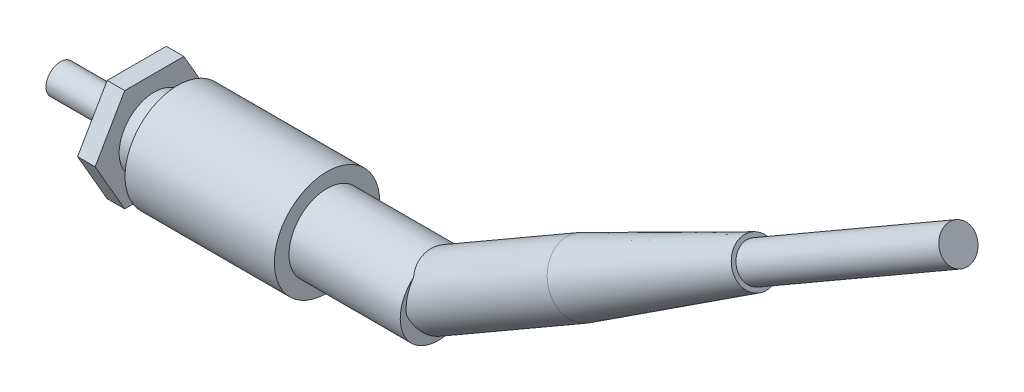
from build123d import *

# Parameters (mm, degrees)
BOSS_EXTRUDE1_DEPTH = 3
SKETCH3_R           = 6
BOSS_EXTRUDE2_DEPTH = 4
SKETCH4_R           = 9
BOSS_EXTRUDE3_DEPTH = 25.5
SKETCH5_R           = 6.5
BOSS_EXTRUDE4_DEPTH = 19
SKETCH6_R           = 2.5
BOSS_EXTRUDE5_DEPTH = 13
SKETCH8_R           = 5.5
BOSS_EXTRUDE6_DEPTH = 29
SKETCH9_R           = 5.5
BOSS_EXTRUDE7_DEPTH = 34
BOSS_EXTRUDE7_TAPER = 3
SKETCH10_R          = 3
BOSS_EXTRUDE8_DEPTH = 40


with BuildPart() as part:
    # Sketch2 → Boss-Extrude1 (new body)
    with BuildSketch(Plane(origin=(-50, 0, 0), x_dir=(0, 0, -1), z_dir=(1, 0, 0))):
        Polygon((-5.051814855, 8.75), (-10.103629711, 0), (-5.051814855, -8.75), (5.051814855, -8.75), (10.103629711, 0), (5.051814855, 8.75), align=None)
    extrude(amount=BOSS_EXTRUDE1_DEPTH)

    # Sketch3 → Boss-Extrude2 (add)
    with BuildSketch(Plane(origin=(-47, 0, 0), x_dir=(0, 0, -1), z_dir=(1, 0, 0))):
        Circle(SKETCH3_R)
    extrude(amount=BOSS_EXTRUDE2_DEPTH)

    # Sketch4 → Boss-Extrude3 (add)
    with BuildSketch(Plane(origin=(-43, 0, 0), x_dir=(0, 0, -1), z_dir=(1, 0, 0))):
        Circle(SKETCH4_R)
    extrude(amount=BOSS_EXTRUDE3_DEPTH)

    # Sketch5 → Boss-Extrude4 (add)
    with BuildSketch(Plane(origin=(-17.5, 0, 0), x_dir=(0, 0, -1), z_dir=(1, 0, 0))):
        Circle(SKETCH5_R)
    extrude(amount=BOSS_EXTRUDE4_DEPTH)

    # Sketch6 → Boss-Extrude5 (add)
    with BuildSketch(Plane.ZY.offset(50)):
        with Locations(Location((0, 0, 0), (0, 0, 180))):
            Circle(SKETCH6_R)
    extrude(amount=BOSS_EXTRUDE5_DEPTH)

    # Sketch8 → Boss-Extrude6 (add)
    with BuildSketch(Plane(origin=(1.125, 0.649519053, 0), x_dir=(0, 0, -1), z_dir=(0.8660254037844379, 0.5000000000000012, 0))):
        with Locations(Location((0, 0, 0), (0, 0, 187.837479763))):
            Circle(SKETCH8_R)
    extrude(amount=BOSS_EXTRUDE6_DEPTH)

    # Sketch9 → Boss-Extrude7 (add)
    with BuildSketch(Plane(origin=(26.23973671, 15.149519053, 0), x_dir=(0, 0, -1), z_dir=(0.8660254037844379, 0.5000000000000012, 0))):
        with Locations(Location((0, 0, 0), (0, 0, 187.837479763))):
            Circle(SKETCH9_R)
    extrude(amount=BOSS_EXTRUDE7_DEPTH, taper=BOSS_EXTRUDE7_TAPER)

    # Sketch10 → Boss-Extrude8 (add)
    with BuildSketch(Plane(origin=(55.684600438, 32.149519053, 0), x_dir=(0, 0, -1), z_dir=(0.8660254037844379, 0.5000000000000012, 0))):
        with Locations(Location((0, 0, 0), (0, 0, 90))):
            Circle(SKETCH10_R)
    extrude(amount=BOSS_EXTRUDE8_DEPTH)


solid = part.part
